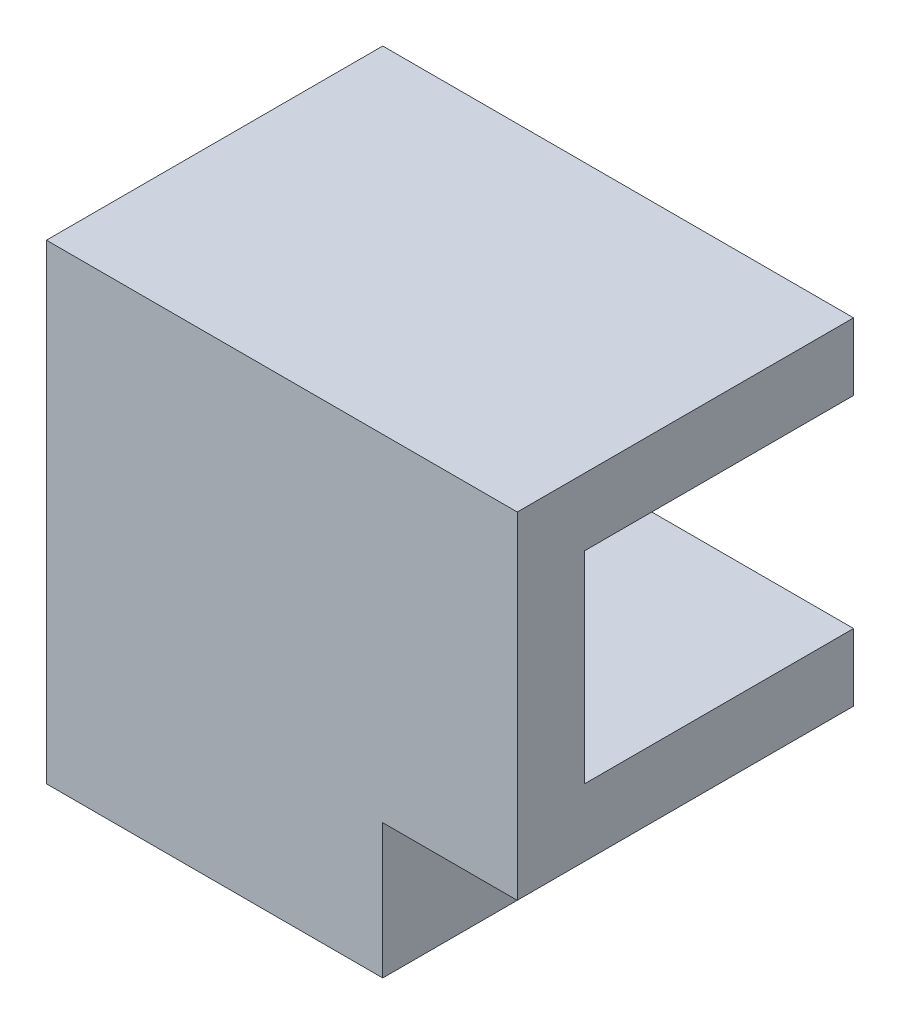
from build123d import *

# Parameters (mm, degrees)
BOSS_EXTRU_1_DEPTH      = 5
ESQUISSE2_W             = 3
ESQUISSE2_H             = 4
ENL_V_MAT_EXTRU_1_DEPTH = 6
ESQUISSE3_W             = 4
ESQUISSE3_H             = 3
ENL_V_MAT_EXTRU_2_DEPTH = 6


with BuildPart() as part:
    # Esquisse1 → Boss.-Extru.1 (new body)
    with BuildSketch(Plane.XY):
        Polygon((-1.317889251, -4.63356974), (-1.317889251, -2.63356974), (0.682110749, -2.63356974), (0.682110749, 2.36643026), (-6.317889251, 2.36643026), (-6.317889251, -4.63356974), align=None)
    extrude(amount=BOSS_EXTRU_1_DEPTH)

    # Esquisse2 → Enlèv. mat.-Extru.1 (cut)
    with BuildSketch(Plane.XZ.offset(4.63356974)):
        with Locations((-3.817889251, 2)):
            Rectangle(ESQUISSE2_W, ESQUISSE2_H)
    extrude(amount=-ENL_V_MAT_EXTRU_1_DEPTH, mode=Mode.SUBTRACT)

    # Esquisse3 → Enlèv. mat.-Extru.2 (cut)
    with BuildSketch(Plane(origin=(0.682110749, 0, 0), x_dir=(0, 0, -1), z_dir=(1, 0, 0))):
        with Locations((-2, -0.13356974)):
            Rectangle(ESQUISSE3_W, ESQUISSE3_H)
    extrude(amount=-ENL_V_MAT_EXTRU_2_DEPTH, mode=Mode.SUBTRACT)


solid = part.part
